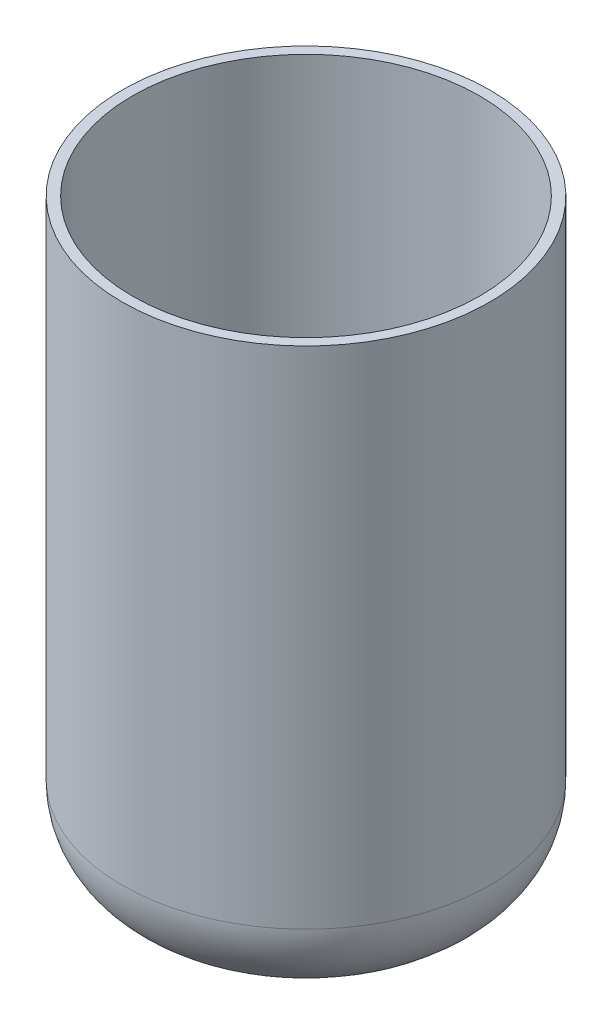
from build123d import *

# Parameters (mm, degrees)
NECK_SKETCH_R = 4.5
NECK_DEPTH    = 61
TOP_ROUND_R   = 8
BLEND_R       = 0.5


with BuildPart() as part:
    # Outside Profile_Sketch → Outside Profile (revolve)
    with BuildSketch(Plane.XY):
        Polygon((0, 0), (-18, 0), (-18, -55.9), (-4.5, -58.9), (0, -58.9), align=None)
    revolve(axis=Axis((0, 0, 0), (0, -1, 0)))

    # Neck_Sketch → Neck (add)
    with BuildSketch(Plane(origin=(0, 0, 0), x_dir=(1, 0, 0), z_dir=(0, 1, 0))):
        Circle(NECK_SKETCH_R)
    extrude(amount=-NECK_DEPTH)

    # Top Round
    top_round_edges = [part.edges().sort_by_distance(p)[0] for p in [
        (18, -55.9, 0),
    ]]
    fillet(top_round_edges, radius=TOP_ROUND_R)

    # Blend
    blend_edges = [part.edges().sort_by_distance(p)[0] for p in [
        (0, -58.9, -4.5),
    ]]
    fillet(blend_edges, radius=BLEND_R)

    # Shell_Sketch → Shell (revolve, cut)
    with BuildSketch(Plane.XY):
        with BuildLine():
            Line((-4.283069542, -57.92381294), (0, -57.92381294))
            Line((0, -57.92381294), (0, 0))
            Line((0, 0), (-17, 0))
            Line((-17, 0), (-17, -49.482627149))
            ThreePointArc((-17, -49.482627149), (-15.460292686, -53.862718904), (-11.518513205, -56.31593657))
            Line((-11.518513205, -56.31593657), (-4.283069542, -57.92381294))
        make_face()
    revolve(axis=Axis((0, 0, 0), (0, -1, 0)), mode=Mode.SUBTRACT)


solid = part.part
